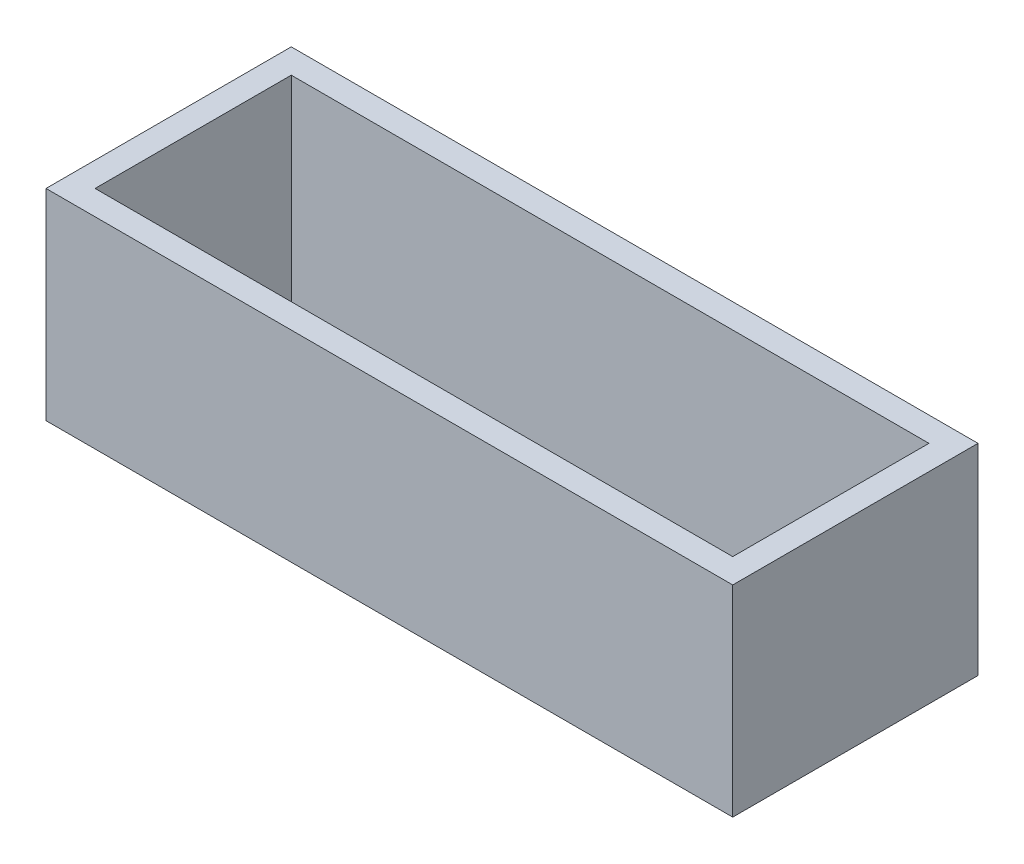
from build123d import *

# Parameters (mm, degrees)
SKETCH1_W           = 355.6
SKETCH1_H           = 127
BOSS_EXTRUDE1_DEPTH = 2.54
SKETCH2_W           = 355.6
SKETCH2_H           = 127
SKETCH2_W_2         = 330.2
SKETCH2_H_2         = 101.6
BOSS_EXTRUDE2_DEPTH = 101.6


with BuildPart() as part:
    # Sketch1 → Boss-Extrude1 (new body)
    with BuildSketch(Plane(origin=(0, 0, 0), x_dir=(1, 0, 0), z_dir=(0, 1, 0))):
        Rectangle(SKETCH1_W, SKETCH1_H)
    extrude(amount=BOSS_EXTRUDE1_DEPTH)

    # Sketch2 → Boss-Extrude2 (add)
    with BuildSketch(Plane(origin=(0, 2.54, 0), x_dir=(1, 0, 0), z_dir=(0, 1, 0))):
        Rectangle(SKETCH2_W, SKETCH2_H)
        Rectangle(SKETCH2_W_2, SKETCH2_H_2, mode=Mode.SUBTRACT)
    extrude(amount=BOSS_EXTRUDE2_DEPTH)


solid = part.part
